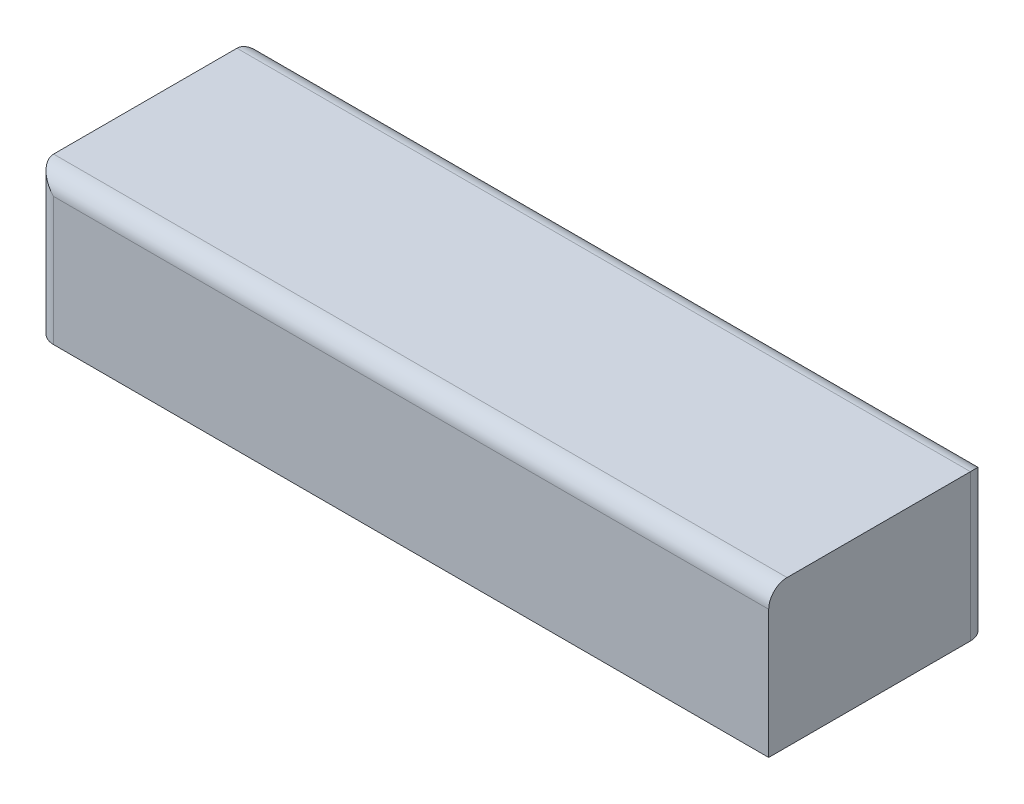
from build123d import *

# Parameters (mm, degrees)
SKETCH2_W           = 40
SKETCH2_H           = 12
BOSS_EXTRUDE2_DEPTH = 8
FILLET1_R           = 1


with BuildPart() as part:
    # Sketch2 → Boss-Extrude2 (new body)
    with BuildSketch(Plane(origin=(0, 0, 0), x_dir=(1, 0, 0), z_dir=(0, 1, 0))):
        with Locations((20, 6)):
            Rectangle(SKETCH2_W, SKETCH2_H)
    extrude(amount=BOSS_EXTRUDE2_DEPTH)

    # Fillet1
    fillet1_edges = [part.edges().sort_by_distance(p)[0] for p in [
        (20, 8, -12),
        (0, 4, -12),
        (40, 4, -12),
        (0, 4, 0),
        (20, 8, 0),
    ]]
    fillet(fillet1_edges, radius=FILLET1_R)


solid = part.part
